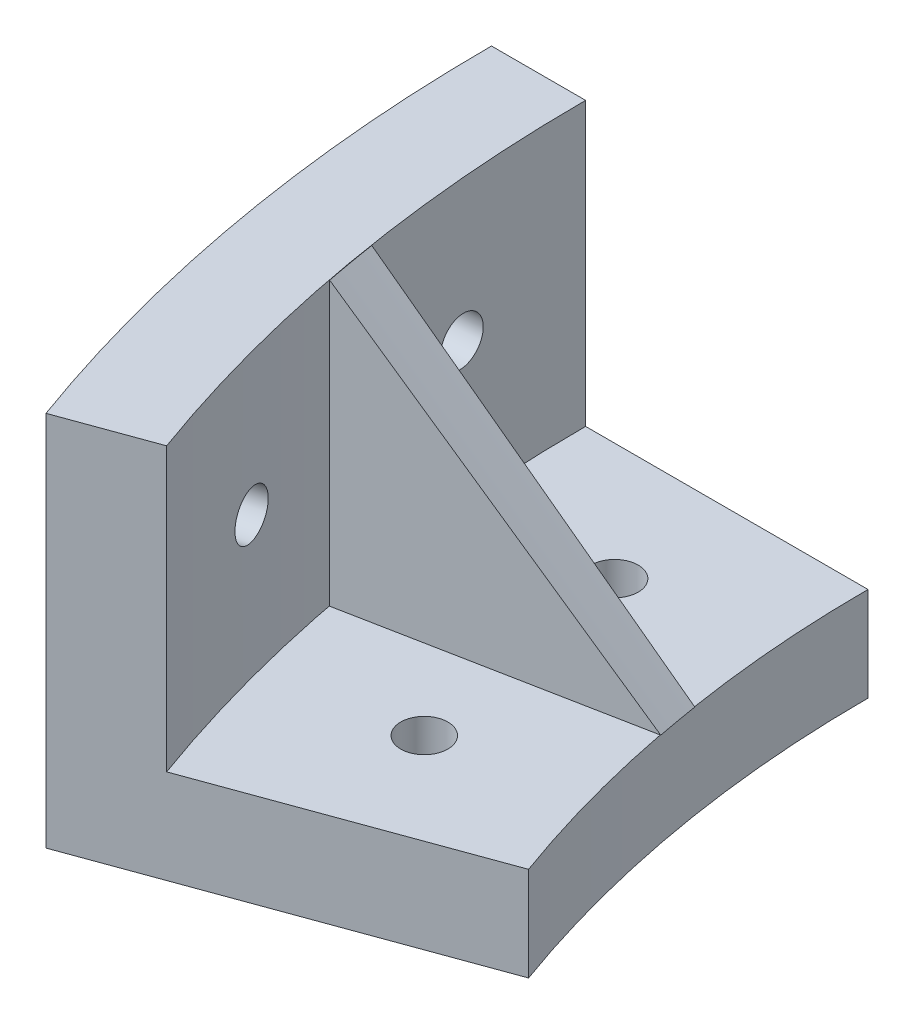
from build123d import *

# Parameters (mm, degrees)
R_VOLUTION1_ANGLE            = 20
ESQUISSE4_R                  = 1.25
ENL_V_MAT_EXTRU_1_DEPTH      = 10
ESQUISSE7_R                  = 1.25
ENL_V_MAT_EXTRU_2_DEPTH      = 10
R_P_TITION_CIRCULAIRE1_COUNT = 2
R_P_TITION_CIRCULAIRE1_ANGLE = 10
R_VOLUTION2_ANGLE            = 1
R_VOLUTION2_OTHER_WAY_ANGLE  = 1


with BuildPart() as part:
    # Esquisse2 → Révolution1 (revolve)
    with BuildSketch(Plane.XY):
        Polygon((0, 0), (20, 0), (20, 5), (5, 5), (5, 20), (0, 20), align=None)
    revolve(axis=Axis((84, 0, 0), (0, 1, 0)), revolution_arc=R_VOLUTION1_ANGLE)

    # Esquisse4 → Enlèv. mat.-Extru.1 (cut)
    with BuildSketch(Plane(origin=(0, 5, 0), x_dir=(1, 0, 0), z_dir=(0, 1, 0))):
        with Locations(Location((14.93630342, -18.505561725, 0), (0, 0, 270))):
            Circle(ESQUISSE4_R)
        with Locations(Location((12.772079086, -6.231635606, 0), (0, 0, 270))):
            Circle(ESQUISSE4_R)
    extrude(amount=-ENL_V_MAT_EXTRU_1_DEPTH, mode=Mode.SUBTRACT)

    # Esquisse7 → Enlèv. mat.-Extru.2 (cut)
    with BuildSketch(Plane(origin=(-0.318429013, 0, 0.027858929), x_dir=(0, -1, 0), z_dir=(-0.9961946980917459, 0, 0.08715574274765504))):
        with Locations(Location((-12.5, 7.321082391, 0), (0, 0, 90))):
            Circle(ESQUISSE7_R)
    enl_v_mat_extru_2 = extrude(amount=-ENL_V_MAT_EXTRU_2_DEPTH, mode=Mode.SUBTRACT)

    # Répétition circulaire1: Enlèv. mat.-Extru.2 ×2 about axis
    r_p_tition_circulaire1_axis = Axis((84, 0, 0), (0, 1, 0))
    for i in range(1, R_P_TITION_CIRCULAIRE1_COUNT):
        add(enl_v_mat_extru_2.rotate(r_p_tition_circulaire1_axis, i * R_P_TITION_CIRCULAIRE1_ANGLE / (R_P_TITION_CIRCULAIRE1_COUNT - 1)), mode=Mode.SUBTRACT)

    # Esquisse9 → Révolution2 (revolve)
    with BuildSketch(Plane(origin=(2.532909927, 0, 14.36484602), x_dir=(-0.9848077530122081, 0, 0.17364817766693072), z_dir=(-0.17364817766693072, 0, -0.9848077530122081))):
        Polygon((-3.746639624, 5), (-3.746639624, 20), (-18.746639624, 5), align=None)
    revolve(axis=Axis((84, 0, 0), (0, -1, 0)), revolution_arc=R_VOLUTION2_ANGLE)

    # Esquisse9 → Révolution2 other way (revolve)
    with BuildSketch(Plane(origin=(2.532909927, 0, 14.36484602), x_dir=(-0.9848077530122081, 0, 0.17364817766693072), z_dir=(-0.17364817766693072, 0, -0.9848077530122081))):
        Polygon((-3.746639624, 5), (-3.746639624, 20), (-18.746639624, 5), align=None)
    revolve(axis=Axis((84, 0, 0), (0, 1, 0)), revolution_arc=R_VOLUTION2_OTHER_WAY_ANGLE)


solid = part.part
